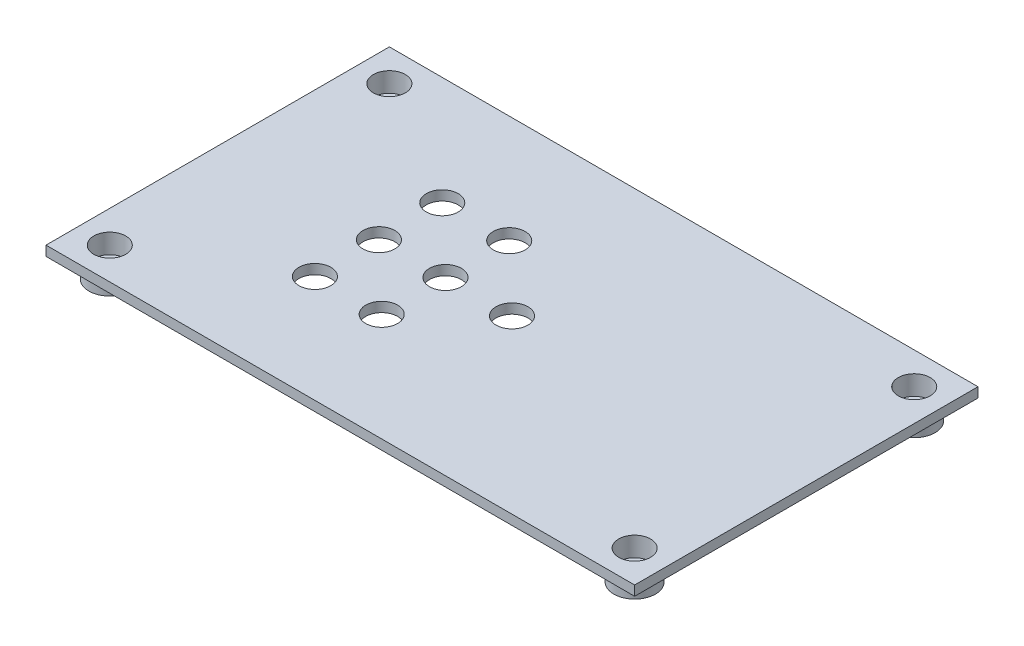
from build123d import *

# Parameters (mm, degrees)
SKETCH1_W           = 120
SKETCH1_H           = 70
BOSS_EXTRUDE1_DEPTH = 2
SKETCH6_R           = 2
BOSS_EXTRUDE2_DEPTH = 11
SKETCH4_R           = 3.25
CUT_EXTRUDE2_DEPTH  = 11
SKETCH3_R           = 4.25
BOSS_EXTRUDE3_DEPTH = 6
SKETCH8_R           = 1.75
CUT_EXTRUDE6_DEPTH  = 8
SKETCH9_R           = 3.25
CUT_EXTRUDE8_DEPTH  = 4


with BuildPart() as part:
    # Sketch1 → Boss-Extrude1 (new body)
    with BuildSketch(Plane(origin=(0, 0, 0), x_dir=(1, 0, 0), z_dir=(0, 1, 0))):
        Rectangle(SKETCH1_W, SKETCH1_H)
    extrude(amount=BOSS_EXTRUDE1_DEPTH)

    # Sketch6 → Boss-Extrude2 (add)
    with BuildSketch(Plane(origin=(0, 2, 0), x_dir=(1, 0, 0), z_dir=(0, 1, 0))):
        with Locations(Location((0, -13, 0), (0, 0, 270))):
            Circle(SKETCH6_R)
        with Locations(Location((0, 13, 0), (0, 0, 270))):
            Circle(SKETCH6_R)
    extrude(amount=-BOSS_EXTRUDE2_DEPTH)

    # Sketch4 → Cut-Extrude2 (cut)
    with BuildSketch(Plane(origin=(0, 2, 0), x_dir=(1, 0, 0), z_dir=(0, 1, 0))):
        with Locations(Location((-27.054448087, -13.122273409, 0), (0, 0, 270))):
            Circle(SKETCH4_R)
        with Locations(Location((-27.023483048, -0.10764713, 0), (0, 0, 270))):
            Circle(SKETCH4_R)
        with Locations(Location((-27.081562274, 12.864019897, 0), (0, 0, 270))):
            Circle(SKETCH4_R)
        with Locations(Location((-13.567081484, 0, 0), (0, 0, 270))):
            Circle(SKETCH4_R)
        with Locations(Location((-13.567081484, -13, 0), (0, 0, 270))):
            Circle(SKETCH4_R)
        with Locations(Location((-13.567081484, 13, 0), (0, 0, 270))):
            Circle(SKETCH4_R)
        with Locations(Location((0, 0, 0), (0, 0, 270))):
            Circle(SKETCH4_R)
    extrude(amount=-CUT_EXTRUDE2_DEPTH, mode=Mode.SUBTRACT)

    # Sketch3 → Boss-Extrude3 (add)
    with BuildSketch(Plane(origin=(0, 2, 0), x_dir=(1, 0, 0), z_dir=(0, 1, 0))):
        with Locations(Location((-53.5, 28.5, 0), (0, 0, 270))):
            Circle(SKETCH3_R)
        with Locations(Location((53.5, 28.5, 0), (0, 0, 270))):
            Circle(SKETCH3_R)
        with Locations(Location((-53.5, -28.5, 0), (0, 0, 270))):
            Circle(SKETCH3_R)
        with Locations(Location((53.5, -28.5, 0), (0, 0, 270))):
            Circle(SKETCH3_R)
    extrude(amount=-BOSS_EXTRUDE3_DEPTH)

    # Sketch8 → Cut-Extrude6 (cut)
    with BuildSketch(Plane(origin=(0, 2, 0), x_dir=(1, 0, 0), z_dir=(0, 1, 0))):
        with Locations(Location((-53.5, 28.5, 0), (0, 0, 270))):
            Circle(SKETCH8_R)
        with Locations(Location((-53.5, -28.5, 0), (0, 0, 270))):
            Circle(SKETCH8_R)
        with Locations(Location((53.5, -28.5, 0), (0, 0, 270))):
            Circle(SKETCH8_R)
        with Locations(Location((53.5, 28.5, 0), (0, 0, 270))):
            Circle(SKETCH8_R)
    extrude(amount=-CUT_EXTRUDE6_DEPTH, mode=Mode.SUBTRACT)

    # Sketch9 → Cut-Extrude8 (cut)
    with BuildSketch(Plane(origin=(0, 2, 0), x_dir=(1, 0, 0), z_dir=(0, 1, 0))):
        with Locations(Location((-53.5, 28.5, 0), (0, 0, 270))):
            Circle(SKETCH9_R)
        with Locations(Location((53.5, 28.5, 0), (0, 0, 270))):
            Circle(SKETCH9_R)
        with Locations(Location((-53.5, -28.5, 0), (0, 0, 270))):
            Circle(SKETCH9_R)
        with Locations(Location((53.5, -28.5, 0), (0, 0, 270))):
            Circle(SKETCH9_R)
    extrude(amount=-CUT_EXTRUDE8_DEPTH, mode=Mode.SUBTRACT)


solid = part.part
